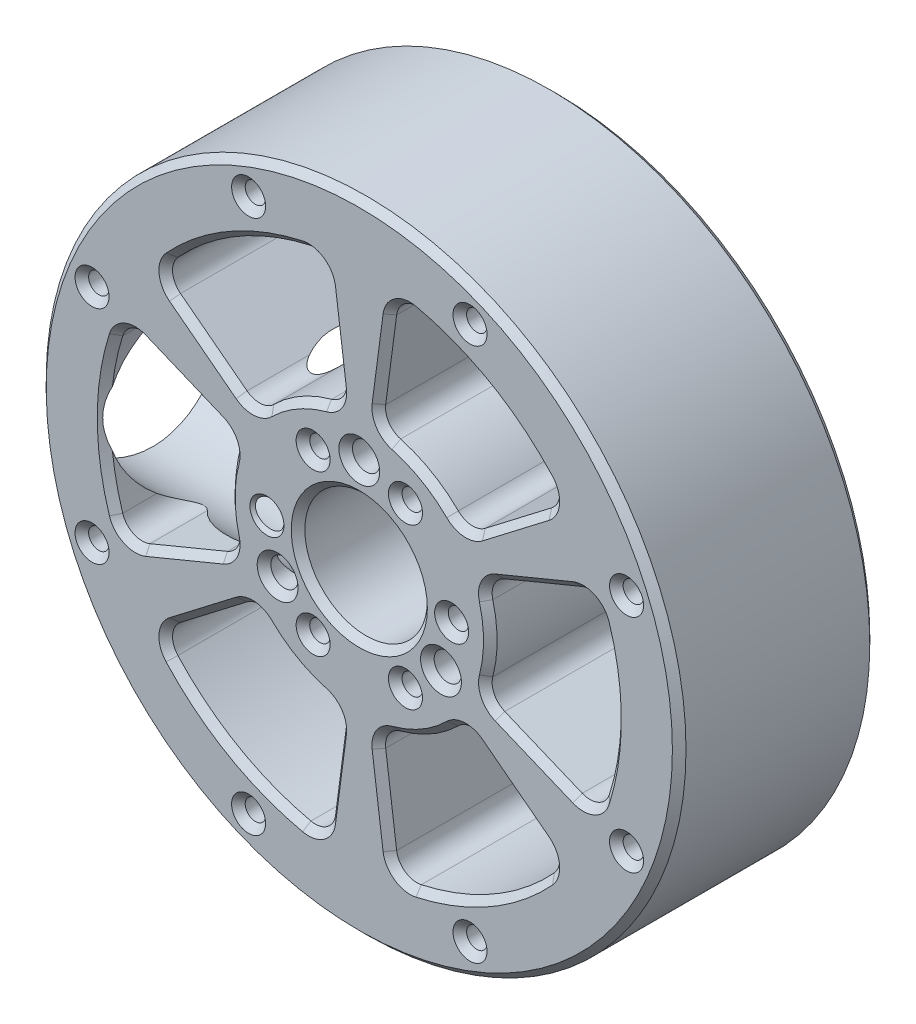
from build123d import *

# Parameters (mm, degrees)
SKETCH_1_R          = 47
SKETCH_1_R_2        = 1.5
SKETCH_1_R_3        = 9
SKETCH_1_R_4        = 2
EXTRUDE_1_DEPTH     = 29
CHAMFER_1_SIZE      = 1
SKETCH_2_R          = 14.1
CUT_EXTRUDE_1_DEPTH = 54


with BuildPart() as part:
    # 草图1 → 凸台-拉伸1 (new body)
    with BuildSketch(Plane.XY):
        with Locations(Location((0, 0, 0), (0, 0, 180))):
            Circle(SKETCH_1_R)
        with Locations(Location((16.264045876, 39.264880132, 0), (0, 0, 180))):
            Circle(SKETCH_1_R_2, mode=Mode.SUBTRACT)
        with Locations(Location((-16.264045876, 39.264880132, 0), (0, 0, 180))):
            Circle(SKETCH_1_R_2, mode=Mode.SUBTRACT)
        with Locations(Location((-39.264880132, 16.264045876, 0), (0, 0, 180))):
            Circle(SKETCH_1_R_2, mode=Mode.SUBTRACT)
        with Locations(Location((-39.264880132, -16.264045876, 0), (0, 0, 180))):
            Circle(SKETCH_1_R_2, mode=Mode.SUBTRACT)
        with Locations(Location((-16.264045876, -39.264880132, 0), (0, 0, 180))):
            Circle(SKETCH_1_R_2, mode=Mode.SUBTRACT)
        with Locations(Location((16.264045876, -39.264880132, 0), (0, 0, 180))):
            Circle(SKETCH_1_R_2, mode=Mode.SUBTRACT)
        with Locations(Location((39.264880132, -16.264045876, 0), (0, 0, 180))):
            Circle(SKETCH_1_R_2, mode=Mode.SUBTRACT)
        with Locations(Location((39.264880132, 16.264045876, 0), (0, 0, 180))):
            Circle(SKETCH_1_R_2, mode=Mode.SUBTRACT)
        with Locations(Location((0, 0, 0), (0, 0, 180))):
            Circle(SKETCH_1_R_3, mode=Mode.SUBTRACT)
        with Locations(Location((6.783865663, 11.75, 0), (0, 0, 180))):
            Circle(SKETCH_1_R_2, mode=Mode.SUBTRACT)
        with Locations(Location((-6.783865663, 11.75, 0), (0, 0, 180))):
            Circle(SKETCH_1_R_2, mode=Mode.SUBTRACT)
        with Locations(Location((-13.567731326, 0, 0), (0, 0, 180))):
            Circle(SKETCH_1_R_2, mode=Mode.SUBTRACT)
        with Locations(Location((-6.783865663, -11.75, 0), (0, 0, 180))):
            Circle(SKETCH_1_R_2, mode=Mode.SUBTRACT)
        with Locations(Location((6.783865663, -11.75, 0), (0, 0, 180))):
            Circle(SKETCH_1_R_2, mode=Mode.SUBTRACT)
        with Locations(Location((13.567731326, 0, 0), (0, 0, 180))):
            Circle(SKETCH_1_R_2, mode=Mode.SUBTRACT)
        with Locations(Location((0, 13.856406461, 0), (0, 0, 180))):
            Circle(SKETCH_1_R_4, mode=Mode.SUBTRACT)
        with Locations(Location((12, -6.92820323, 0), (0, 0, 180))):
            Circle(SKETCH_1_R_4, mode=Mode.SUBTRACT)
        with Locations(Location((-12, -6.92820323, 0), (0, 0, 180))):
            Circle(SKETCH_1_R_4, mode=Mode.SUBTRACT)
        with BuildLine():
            Line((4.48609617, 34.075283435), (2.87768814, 21.858211523))
            ThreePointArc((2.87768814, 21.858211523), (3.353999949, 19.805343623), (5.062985952, 18.57225547))
            ThreePointArc((5.062985952, 18.57225547), (9.625, 16.670989023), (13.552552067, 13.670802189))
            ThreePointArc((13.552552067, 13.670802189), (15.474930734, 12.807320971), (17.49092239, 13.421256795))
            Line((17.49092239, 13.421256795), (27.26701301, 20.922714965))
            ThreePointArc((27.26701301, 20.922714965), (28.429286659, 23.04100893), (27.652966004, 25.329103245))
            ThreePointArc((27.652966004, 25.329103245), (18.75, 32.475952642), (8.109163863, 36.612722672))
            ThreePointArc((8.109163863, 36.612722672), (5.739455732, 36.140988923), (4.48609617, 34.075283435))
        make_face(mode=Mode.SUBTRACT)
        with BuildLine():
            Line((31.753109181, 13.15256847), (20.36861053, 8.436954728))
            ThreePointArc((20.36861053, 8.436954728), (18.828930683, 6.998022652), (18.615538019, 4.901453282))
            ThreePointArc((18.615538019, 4.901453282), (19.25, 0), (18.615538019, -4.901453282))
            ThreePointArc((18.615538019, -4.901453282), (18.828930683, -6.998022652), (20.36861053, -8.436954728))
            Line((20.36861053, -8.436954728), (31.753109181, -13.15256847))
            ThreePointArc((31.753109181, -13.15256847), (34.168742391, -13.099979993), (35.762129867, -11.283619427))
            ThreePointArc((35.762129867, -11.283619427), (37.5, 0), (35.762129867, 11.283619427))
            ThreePointArc((35.762129867, 11.283619427), (34.168742391, 13.099979993), (31.753109181, 13.15256847))
        make_face(mode=Mode.SUBTRACT)
        with BuildLine():
            Line((27.26701301, -20.922714965), (17.49092239, -13.421256795))
            ThreePointArc((17.49092239, -13.421256795), (15.474930734, -12.807320971), (13.552552067, -13.670802189))
            ThreePointArc((13.552552067, -13.670802189), (9.625, -16.670989023), (5.062985952, -18.57225547))
            ThreePointArc((5.062985952, -18.57225547), (3.353999949, -19.805343623), (2.87768814, -21.858211523))
            Line((2.87768814, -21.858211523), (4.48609617, -34.075283435))
            ThreePointArc((4.48609617, -34.075283435), (5.739455732, -36.140988923), (8.109163863, -36.612722672))
            ThreePointArc((8.109163863, -36.612722672), (18.75, -32.475952642), (27.652966004, -25.329103245))
            ThreePointArc((27.652966004, -25.329103245), (28.429286659, -23.04100893), (27.26701301, -20.922714965))
        make_face(mode=Mode.SUBTRACT)
        with BuildLine():
            Line((-4.48609617, -34.075283435), (-2.87768814, -21.858211523))
            ThreePointArc((-2.87768814, -21.858211523), (-3.353999949, -19.805343623), (-5.062985952, -18.57225547))
            ThreePointArc((-5.062985952, -18.57225547), (-9.625, -16.670989023), (-13.552552067, -13.670802189))
            ThreePointArc((-13.552552067, -13.670802189), (-15.474930734, -12.807320971), (-17.49092239, -13.421256795))
            Line((-17.49092239, -13.421256795), (-27.26701301, -20.922714965))
            ThreePointArc((-27.26701301, -20.922714965), (-28.429286659, -23.04100893), (-27.652966004, -25.329103245))
            ThreePointArc((-27.652966004, -25.329103245), (-18.75, -32.475952642), (-8.109163863, -36.612722672))
            ThreePointArc((-8.109163863, -36.612722672), (-5.739455732, -36.140988923), (-4.48609617, -34.075283435))
        make_face(mode=Mode.SUBTRACT)
        with BuildLine():
            Line((-31.753109181, -13.15256847), (-20.36861053, -8.436954728))
            ThreePointArc((-20.36861053, -8.436954728), (-18.828930683, -6.998022652), (-18.615538019, -4.901453282))
            ThreePointArc((-18.615538019, -4.901453282), (-19.25, 0), (-18.615538019, 4.901453282))
            ThreePointArc((-18.615538019, 4.901453282), (-18.828930683, 6.998022652), (-20.36861053, 8.436954728))
            Line((-20.36861053, 8.436954728), (-31.753109181, 13.15256847))
            ThreePointArc((-31.753109181, 13.15256847), (-34.168742391, 13.099979993), (-35.762129867, 11.283619427))
            ThreePointArc((-35.762129867, 11.283619427), (-37.5, 0), (-35.762129867, -11.283619427))
            ThreePointArc((-35.762129867, -11.283619427), (-34.168742391, -13.099979993), (-31.753109181, -13.15256847))
        make_face(mode=Mode.SUBTRACT)
        with BuildLine():
            Line((-27.26701301, 20.922714965), (-17.49092239, 13.421256795))
            ThreePointArc((-17.49092239, 13.421256795), (-15.474930734, 12.807320971), (-13.552552067, 13.670802189))
            ThreePointArc((-13.552552067, 13.670802189), (-9.625, 16.670989023), (-5.062985952, 18.57225547))
            ThreePointArc((-5.062985952, 18.57225547), (-3.353999949, 19.805343623), (-2.87768814, 21.858211523))
            Line((-2.87768814, 21.858211523), (-4.48609617, 34.075283435))
            ThreePointArc((-4.48609617, 34.075283435), (-5.739455732, 36.140988923), (-8.109163863, 36.612722672))
            ThreePointArc((-8.109163863, 36.612722672), (-18.75, 32.475952642), (-27.652966004, 25.329103245))
            ThreePointArc((-27.652966004, 25.329103245), (-28.429286659, 23.04100893), (-27.26701301, 20.922714965))
        make_face(mode=Mode.SUBTRACT)
    extrude(amount=EXTRUDE_1_DEPTH)

    # 倒角1
    chamfer_1_edges = [part.edges().sort_by_distance(p)[0] for p in [
        (34.168742391, -13.099979993, 0),
        (37.5, 0, 0),
        (34.168742391, 13.099979993, 0),
        (26.060859855, 10.794761599, 0),
        (18.828930683, 6.998022652, 0),
        (19.25, 0, 0),
        (18.828930683, -6.998022652, 0),
        (26.060859855, -10.794761599, 0),
        (34.168742391, -13.099979993, 29),
        (37.5, 0, 29),
        (34.168742391, 13.099979993, 29),
        (26.060859855, 10.794761599, 29),
        (18.828930683, 6.998022652, 29),
        (19.25, 0, 29),
        (18.828930683, -6.998022652, 29),
        (26.060859855, -10.794761599, 29),
        (28.429286659, 23.04100893, 0),
        (18.75, 32.475952642, 0),
        (5.739455732, 36.140988923, 0),
        (3.681892155, 27.966747479, 0),
        (3.353999949, 19.805343623, 0),
        (5.739455732, -36.140988923, 0),
        (18.75, -32.475952642, 0),
        (28.429286659, -23.04100893, 0),
        (22.3789677, -17.17198588, 0),
        (15.474930734, -12.807320971, 0),
        (9.625, -16.670989023, 0),
        (3.353999949, -19.805343623, 0),
        (3.681892155, -27.966747479, 0),
        (5.739455732, -36.140988923, 29),
        (18.75, -32.475952642, 29),
        (28.429286659, -23.04100893, 29),
        (9.625, 16.670989023, 0),
        (22.3789677, -17.17198588, 29),
        (15.474930734, -12.807320971, 29),
        (9.625, -16.670989023, 29),
        (3.353999949, -19.805343623, 29),
        (3.681892155, -27.966747479, 29),
        (15.474930734, 12.807320971, 0),
        (22.3789677, 17.17198588, 0),
        (28.429286659, 23.04100893, 29),
        (18.75, 32.475952642, 29),
        (5.739455732, 36.140988923, 29),
        (-28.429286659, -23.04100893, 0),
        (-18.75, -32.475952642, 0),
        (-5.739455732, -36.140988923, 0),
        (3.681892155, 27.966747479, 29),
        (-3.681892155, -27.966747479, 0),
        (-3.353999949, -19.805343623, 0),
        (-9.625, -16.670989023, 0),
        (-15.474930734, -12.807320971, 0),
        (-22.3789677, -17.17198588, 0),
        (-28.429286659, -23.04100893, 29),
        (-18.75, -32.475952642, 29),
        (-5.739455732, -36.140988923, 29),
        (3.353999949, 19.805343623, 29),
        (-3.681892155, -27.966747479, 29),
        (-3.353999949, -19.805343623, 29),
        (-9.625, -16.670989023, 29),
        (-15.474930734, -12.807320971, 29),
        (-22.3789677, -17.17198588, 29),
        (9.625, 16.670989023, 29),
        (15.474930734, 12.807320971, 29),
        (22.3789677, 17.17198588, 29),
        (-34.168742391, 13.099979993, 0),
        (-37.5, 0, 0),
        (-34.168742391, -13.099979993, 0),
        (-26.060859855, -10.794761599, 0),
        (-18.828930683, -6.998022652, 0),
        (-19.25, 0, 0),
        (-18.828930683, 6.998022652, 0),
        (-26.060859855, 10.794761599, 0),
        (-34.168742391, 13.099979993, 29),
        (-37.5, 0, 29),
        (-34.168742391, -13.099979993, 29),
        (-26.060859855, -10.794761599, 29),
        (-18.828930683, -6.998022652, 29),
        (-19.25, 0, 29),
        (-18.828930683, 6.998022652, 29),
        (-26.060859855, 10.794761599, 29),
        (-5.739455732, 36.140988923, 0),
        (-18.75, 32.475952642, 0),
        (-28.429286659, 23.04100893, 0),
        (-22.3789677, 17.17198588, 0),
        (47, 0, 0),
        (-15.474930734, 12.807320971, 0),
        (-9.625, 16.670989023, 0),
        (-3.353999949, 19.805343623, 0),
        (-3.681892155, 27.966747479, 0),
        (-5.739455732, 36.140988923, 29),
        (-18.75, 32.475952642, 29),
        (-28.429286659, 23.04100893, 29),
        (-22.3789677, 17.17198588, 29),
        (-15.474930734, 12.807320971, 29),
        (-9.625, 16.670989023, 29),
        (-3.353999949, 19.805343623, 29),
        (-3.681892155, 27.966747479, 29),
        (17.764045876, 39.264880132, 0),
        (17.764045876, 39.264880132, 29),
        (-14.764045876, 39.264880132, 0),
        (-14.764045876, 39.264880132, 29),
        (-37.764880132, 16.264045876, 0),
        (-37.764880132, 16.264045876, 29),
        (-37.764880132, -16.264045876, 0),
        (-37.764880132, -16.264045876, 29),
        (-14.764045876, -39.264880132, 0),
        (-14.764045876, -39.264880132, 29),
        (17.764045876, -39.264880132, 0),
        (17.764045876, -39.264880132, 29),
        (47, 0, 29),
        (40.764880132, -16.264045876, 0),
        (40.764880132, -16.264045876, 29),
        (40.764880132, 16.264045876, 0),
        (40.764880132, 16.264045876, 29),
        (9, 0, 0),
        (9, 0, 29),
        (8.283865663, 11.75, 0),
        (8.283865663, 11.75, 29),
        (-5.283865663, 11.75, 0),
        (-5.283865663, 11.75, 29),
        (-12.067731326, 0, 0),
        (-12.067731326, 0, 29),
        (-5.283865663, -11.75, 0),
        (-5.283865663, -11.75, 29),
        (8.283865663, -11.75, 0),
        (8.283865663, -11.75, 29),
        (15.067731326, 0, 0),
        (15.067731326, 0, 29),
        (2, 13.856406461, 0),
        (2, 13.856406461, 29),
        (14, -6.92820323, 0),
        (14, -6.92820323, 29),
        (-10, -6.92820323, 0),
        (-10, -6.92820323, 29),
    ]]
    chamfer(chamfer_1_edges, length=CHAMFER_1_SIZE)

    # 草图2 → 切除-拉伸1 (cut)
    with BuildSketch(Plane(origin=(-64.264880132, 0, 0), x_dir=(0, 0, -1), z_dir=(1, 0, 0))):
        with Locations(Location((-14.5, 0, 0), (0, 0, 325.812316764))):
            Circle(SKETCH_2_R)
    extrude(amount=CUT_EXTRUDE_1_DEPTH, mode=Mode.SUBTRACT)


solid = part.part
